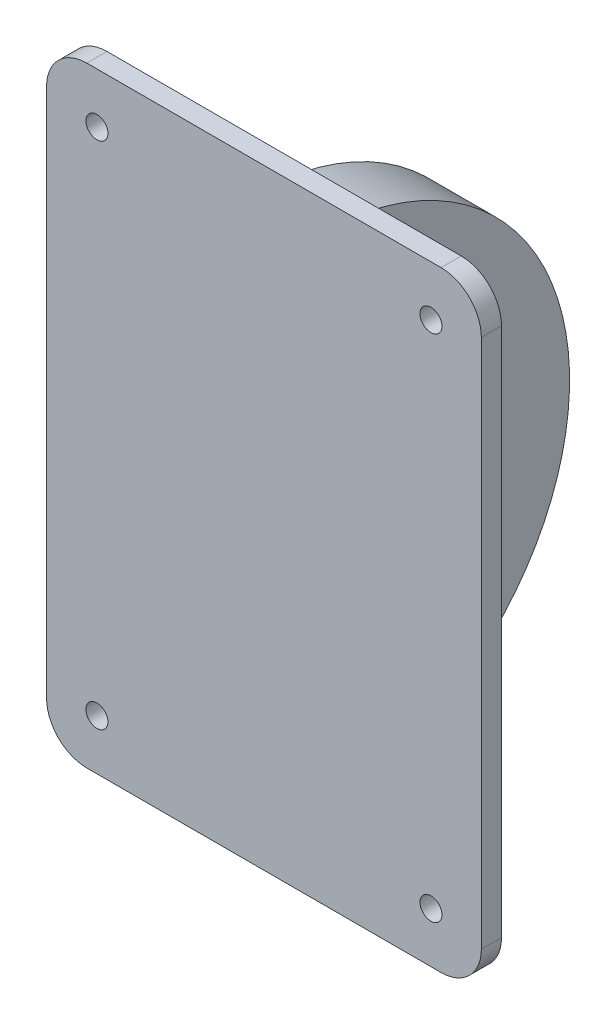
from build123d import *

# Parameters (mm, degrees)
SKETCH1_W           = 43.1509
SKETCH1_H           = 60.58823
BOSS_EXTRUDE1_DEPTH = 2
FILLET1_R           = 4
SKETCH2_R           = 1.0922
CUT_EXTRUDE1_DEPTH  = 2
BOSS_EXTRUDE2_DEPTH = 3.333333333
CUT_EXTRUDE2_REACH  = 48.51
SKETCH6_R           = 3


with BuildPart() as part:
    # Sketch1 → Boss-Extrude1 (new body)
    with BuildSketch(Plane.XY):
        Rectangle(SKETCH1_W, SKETCH1_H)
    extrude(amount=BOSS_EXTRUDE1_DEPTH)

    # Fillet1
    fillet1_edges = [part.edges().sort_by_distance(p)[0] for p in [
        (21.57545, -30.294115, 1),
        (-21.57545, -30.294115, 1),
        (-21.57545, 30.294115, 1),
        (21.57545, 30.294115, 1),
    ]]
    fillet(fillet1_edges, radius=FILLET1_R)

    # Sketch2 → Cut-Extrude1 (cut)
    with BuildSketch(Plane.XY.offset(2)):
        with Locations((-16.57545, 25.294115)):
            Circle(SKETCH2_R)
        with Locations((16.57545, 25.294115)):
            Circle(SKETCH2_R)
        with Locations((-16.57545, -25.294115)):
            Circle(SKETCH2_R)
        with Locations((16.57545, -25.294115)):
            Circle(SKETCH2_R)
    extrude(amount=-CUT_EXTRUDE1_DEPTH, mode=Mode.SUBTRACT)

    # Sketch5 → Boss-Extrude2 (add, symmetric)
    with BuildSketch(Plane(origin=(0, 0, 0), x_dir=(0, 0, -1), z_dir=(1, 0, 0))):
        with BuildLine():
            Line((0, 25), (0, -25))
            ThreePointArc((0, -25), (25, 0), (0, 25))
        make_face()
    extrude(amount=BOSS_EXTRUDE2_DEPTH, both=True)

    # Sketch6 → Cut-Extrude2 (cut, up to next)
    with BuildSketch(Plane(origin=(3.333333333, 0, 0), x_dir=(0, 0, -1), z_dir=(1, 0, 0)), mode=Mode.PRIVATE) as cut_extrude2_sk1:
        with Locations((10.61, 0)):
            Circle(SKETCH6_R)
    cut_extrude2_tool1 = extrude(cut_extrude2_sk1.sketch, amount=-CUT_EXTRUDE2_REACH, mode=Mode.PRIVATE) & part.part
    add(cut_extrude2_tool1.solids().sort_by_distance((3.333333, 0, -10.61))[0], mode=Mode.SUBTRACT)


solid = part.part
